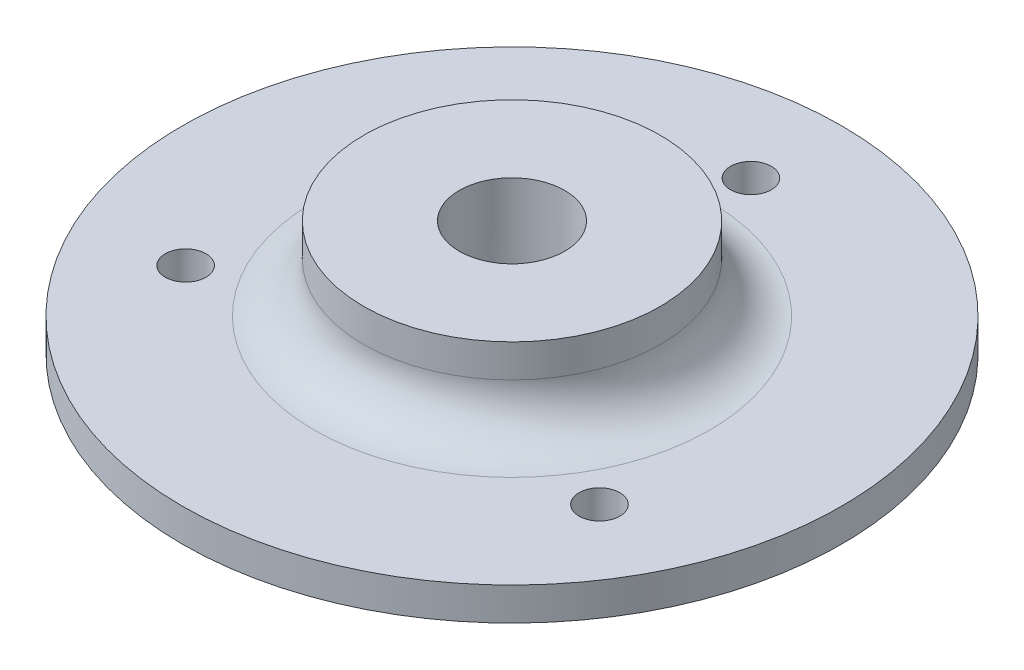
from build123d import *

# Parameters (mm, degrees)
SKETCH2_R          = 1.237013061
CUT_EXTRUDE1_DEPTH = 36.580893749
CIRPATTERN1_COUNT  = 3
FILLET2_R          = 3
FILLET3_R          = 1


with BuildPart() as part:
    # Sketch1 → Revolve1 (revolve)
    with BuildSketch(Plane(origin=(0, 0, 0), x_dir=(0, 0, -1), z_dir=(1, 0, 0))):
        Polygon((0, 0), (0, -5), (-11, -5), (-11, -7), (3.8, -7), (5.8, -5), (5.8, 0), align=None)
    revolve(axis=Axis((0, 1.658614865, -9), (0, -1, 0)))

    # Sketch2 → Cut-Extrude1 (cut, through all)
    with BuildSketch(Plane(origin=(0, -5, 0), x_dir=(1, 0, 0), z_dir=(0, 1, 0))):
        with Locations(Location((0, 23.5, 0), (0, 0, 270))):
            Circle(SKETCH2_R)
    cut_extrude1 = extrude(amount=-CUT_EXTRUDE1_DEPTH, mode=Mode.SUBTRACT)

    # CirPattern1: Cut-Extrude1 ×3 about axis
    cirpattern1_axis = Axis((0, 0, -9), (0, 1, 0))
    for i in range(1, CIRPATTERN1_COUNT):
        add(cut_extrude1.rotate(cirpattern1_axis, i * 360 / CIRPATTERN1_COUNT), mode=Mode.SUBTRACT)

    # Fillet2
    fillet2_edges = [part.edges().sort_by_distance(p)[0] for p in [
        (0, -5, -18),
    ]]
    fillet(fillet2_edges, radius=FILLET2_R)

    # Fillet3
    fillet3_edges = [part.edges().sort_by_distance(p)[0] for p in [
        (0, -5, -12.2),
    ]]
    fillet(fillet3_edges, radius=FILLET3_R)


solid = part.part
